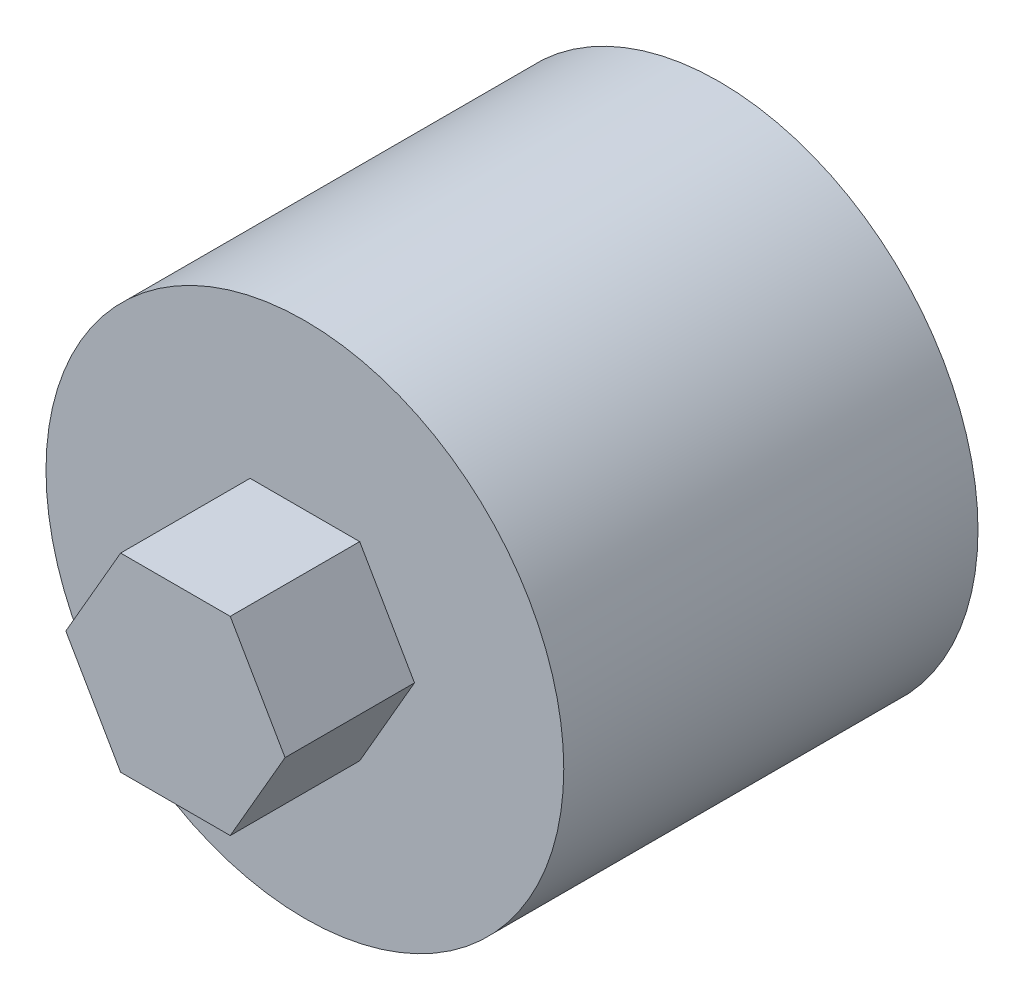
from build123d import *

# Parameters (mm, degrees)
SKETCH_1_R               = 3
SKETCH_1_R_2             = 1.65
EXTRUDE_1_DEPTH          = 4
CUT_EXTRUDE_2_DEPTH      = 6.830951895
PATTERN_CIRCULAR_1_COUNT = 9
SKETCH_2_R               = 3
EXTRUDE_2_DEPTH          = 0.8
EXTRUDE_START            = 0.8
EXTRUDE_3_DEPTH          = 1.5
EXTRUDE_START_2          = -4
SKETCH_2_4_R             = 3
EXTRUDE_4_DEPTH          = 4
CUT_EXTRUDE_3_DEPTH      = 3.8


with BuildPart() as part:
    # 草图1 → 凸台-拉伸1 (new body)
    with BuildSketch(Plane.XY):
        Circle(SKETCH_1_R)
        Circle(SKETCH_1_R_2, mode=Mode.SUBTRACT)
    extrude(amount=EXTRUDE_1_DEPTH)

    # 草图1<3> → 切除-拉伸2 (cut, through all)
    with BuildSketch(Plane.XY):
        with BuildLine():
            Line((1.583201231, 0.595370355), (1.54440693, 0.580781573))
            ThreePointArc((1.54440693, 0.580781573), (1.623387112, 0.295151288), (1.65, 0))
            ThreePointArc((1.65, 0), (1.623387112, -0.295151288), (1.54440693, -0.580781573))
            Line((1.54440693, -0.580781573), (1.583201231, -0.595370355))
            add(Edge.make_bspline(
                [(1.583201231, -0.595370355), (1.595268082, -0.599908151), (1.629927649, -0.609960022), (1.698544644, -0.618780808), (1.810680065, -0.617601716), (1.954246735, -0.59352555), (2.132298369, -0.536822163), (2.302941373, -0.452472776), (2.42578745, -0.372108406), (2.505673341, -0.310927028), (2.533645284, -0.288342805)],
                knots=[0, 0, 0, 0, 0, 0.005604068, 0.015718248, 0.029959916, 0.048733667, 0.068727063, 0.096888892, 0.112551479, 0.112551479, 0.112551479, 0.112551479, 0.112551479], degree=4))
            ThreePointArc((2.533645284, -0.288342805), (2.545908038, -0.144403125), (2.55, 0))
            ThreePointArc((2.55, 0), (2.545908038, 0.144403125), (2.533645284, 0.288342805))
            add(Edge.make_bspline(
                [(1.583201231, 0.595370355), (1.595268082, 0.599908151), (1.629927649, 0.609960022), (1.698544644, 0.618780808), (1.810680065, 0.617601716), (1.954246735, 0.59352555), (2.132298369, 0.536822163), (2.302941373, 0.452472776), (2.42578745, 0.372108406), (2.505673341, 0.310927028), (2.533645284, 0.288342805)],
                knots=[0, 0, 0, 0, 0, 0.005604068, 0.015718248, 0.029959916, 0.048733667, 0.068727063, 0.096888892, 0.112551479, 0.112551479, 0.112551479, 0.112551479, 0.112551479], degree=4))
        make_face()
    cut_extrude_2 = extrude(amount=CUT_EXTRUDE_2_DEPTH, mode=Mode.SUBTRACT)

    # 阵列(圆周)1: 切除-拉伸2 ×9 about axis
    pattern_circular_1_axis = Axis((0, 0, 4), (0, 0, 1))
    for i in range(1, PATTERN_CIRCULAR_1_COUNT):
        add(cut_extrude_2.rotate(pattern_circular_1_axis, i * 360 / PATTERN_CIRCULAR_1_COUNT), mode=Mode.SUBTRACT)

    # 草图2 → 凸台-拉伸2 (add)
    with BuildSketch(Plane.XY.offset(4)):
        Circle(SKETCH_2_R)
    extrude(amount=EXTRUDE_2_DEPTH)

    # 草图2<3> → 凸台-拉伸3 (add)
    with BuildSketch(Plane.XY.offset(4).offset(EXTRUDE_START)):
        Polygon((0.635085296, 1.1), (-0.635085296, 1.1), (-1.270170592, 0), (-0.635085296, -1.1), (0.635085296, -1.1), (1.270170592, 0), align=None)
    extrude(amount=EXTRUDE_3_DEPTH)

    # 草图2<4> → 凸台-拉伸4 (add)
    with BuildSketch(Plane.XY.offset(4).offset(EXTRUDE_START_2)):
        Circle(SKETCH_2_4_R)
    extrude(amount=EXTRUDE_4_DEPTH)

    # 草图3 → 切除-拉伸3 (cut)
    with BuildSketch(Plane(origin=(0, 0, 0), x_dir=(-1, 0, 0), z_dir=(0, 0, -1))):
        with BuildLine():
            Line((1.1, -1.092016483), (1.1, 1.092016483))
            ThreePointArc((1.1, 1.092016483), (-1.55, 0), (1.1, -1.092016483))
        make_face()
    extrude(amount=-CUT_EXTRUDE_3_DEPTH, mode=Mode.SUBTRACT)


solid = part.part
